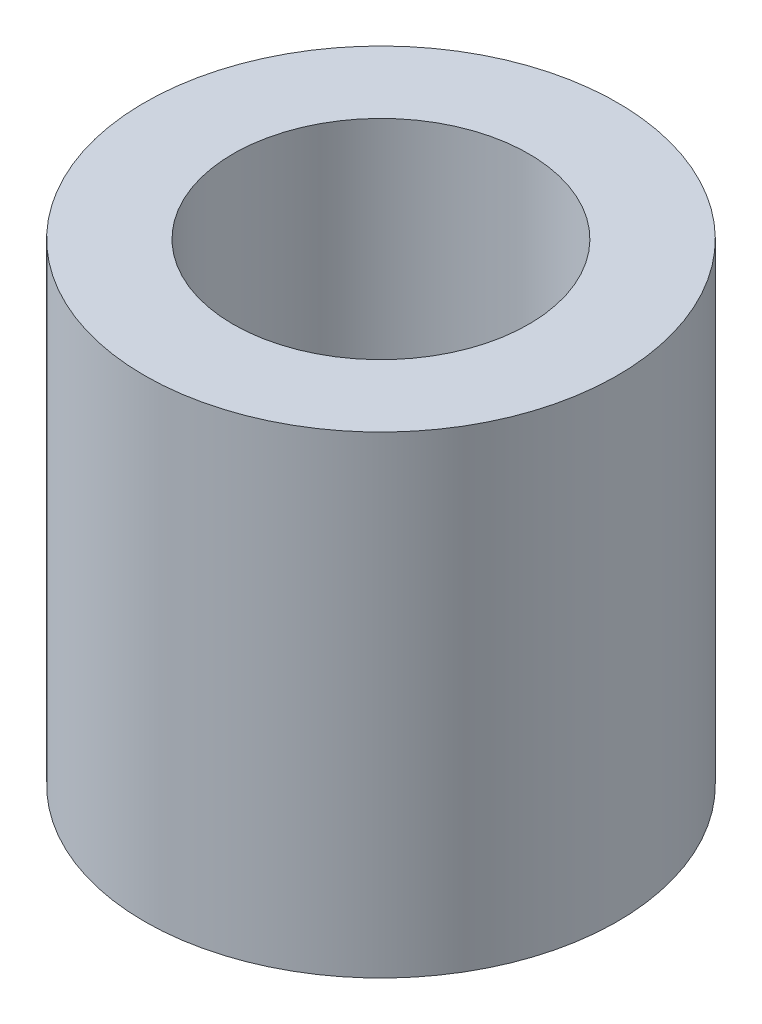
from build123d import *

# Parameters (mm, degrees)
SKETCH_1_R      = 4
SKETCH_1_R_2    = 2.5
EXTRUDE_1_DEPTH = 8


with BuildPart() as part:
    # 草图1 → 凸台-拉伸1 (new body)
    with BuildSketch(Plane(origin=(0, 0, 0), x_dir=(1, 0, 0), z_dir=(0, 1, 0))):
        with Locations(Location((0, 0, 0), (0, 0, 270))):
            Circle(SKETCH_1_R)
        with Locations(Location((0, 0, 0), (0, 0, 270))):
            Circle(SKETCH_1_R_2, mode=Mode.SUBTRACT)
    extrude(amount=EXTRUDE_1_DEPTH)


solid = part.part
